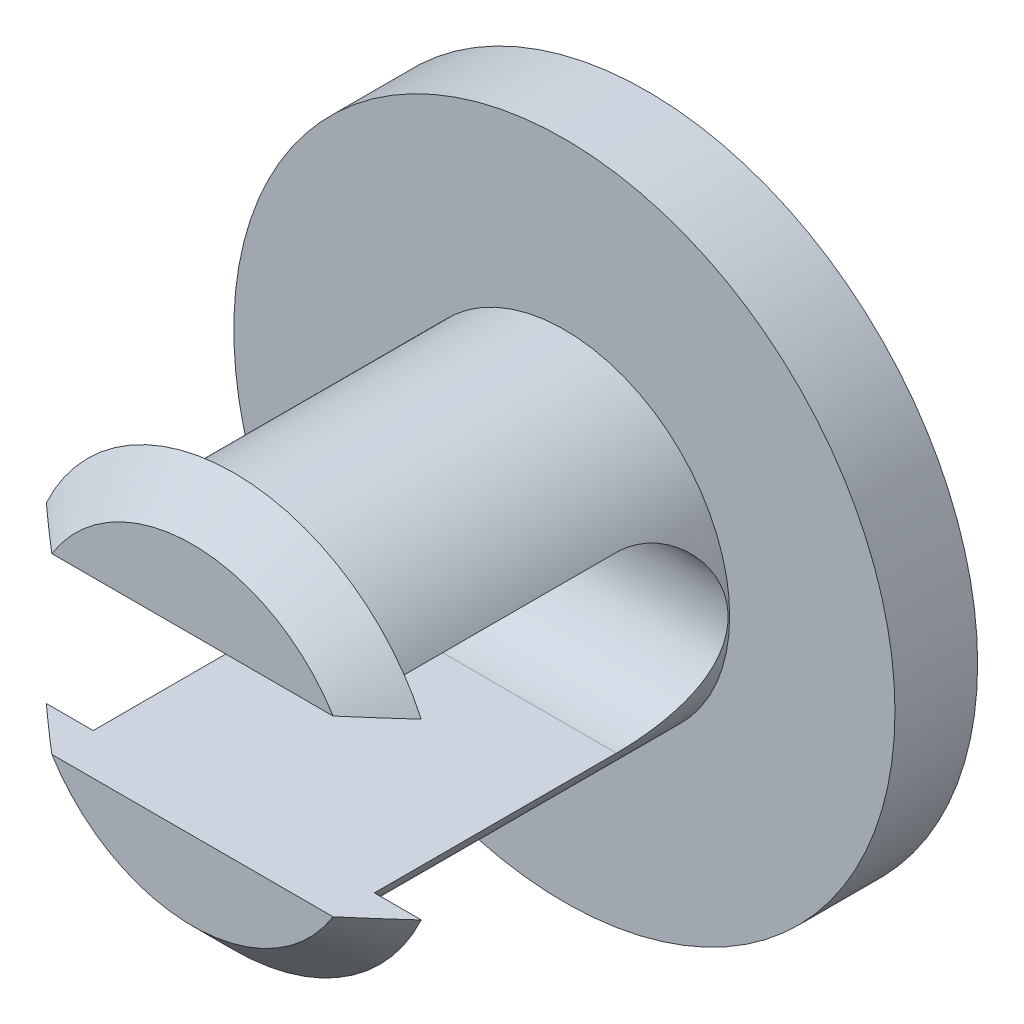
from build123d import *

# Parameters (mm, degrees)
SKETCH1_R               = 8
BOSS_EXTRUDE1_DEPTH     = 2
SKETCH2_R               = 4
BOSS_EXTRUDE2_DEPTH     = 9
SKETCH7_R               = 5
CUT_EXTRUDE1_DEPTH      = 9
CUT_EXTRUDE1_DEPTH_BACK = 9


with BuildPart() as part:
    # Sketch1 → Boss-Extrude1 (new body)
    with BuildSketch(Plane.XY):
        Circle(SKETCH1_R)
    extrude(amount=BOSS_EXTRUDE1_DEPTH)

    # Sketch2 → Boss-Extrude2 (add)
    with BuildSketch(Plane.XY.offset(2)):
        Circle(SKETCH2_R)
    extrude(amount=BOSS_EXTRUDE2_DEPTH)

    # Sketch7 → section 0 of loft1
    with BuildSketch(Plane.XY.offset(10), mode=Mode.PRIVATE) as loft1_s0:
        Circle(SKETCH7_R)
    # loft up to a face of the part (loft1)
    loft([loft1_s0.sketch, part.faces().sort_by_distance((0, 0, 11))[0]])

    # Sketch4 → Cut-Extrude1 (cut, two sides: drawn at the far end of the back side and taken through both)
    with BuildSketch(Plane(origin=(0, 0, 0), x_dir=(0, 0, -1), z_dir=(1, 0, 0)).offset(-CUT_EXTRUDE1_DEPTH_BACK)):
        with BuildLine():
            Line((-11, 2.103629109), (-4.141860423, 2.103629109))
            ThreePointArc((-4.141860423, 2.103629109), (-2.038231313, 0), (-4.141860423, -2.103629109))
            Line((-4.141860423, -2.103629109), (-11, -2.103629109))
            ThreePointArc((-11, -2.103629109), (-13.103629109, 0), (-11, 2.103629109))
        make_face()
    extrude(amount=CUT_EXTRUDE1_DEPTH + CUT_EXTRUDE1_DEPTH_BACK, mode=Mode.SUBTRACT)


solid = part.part
